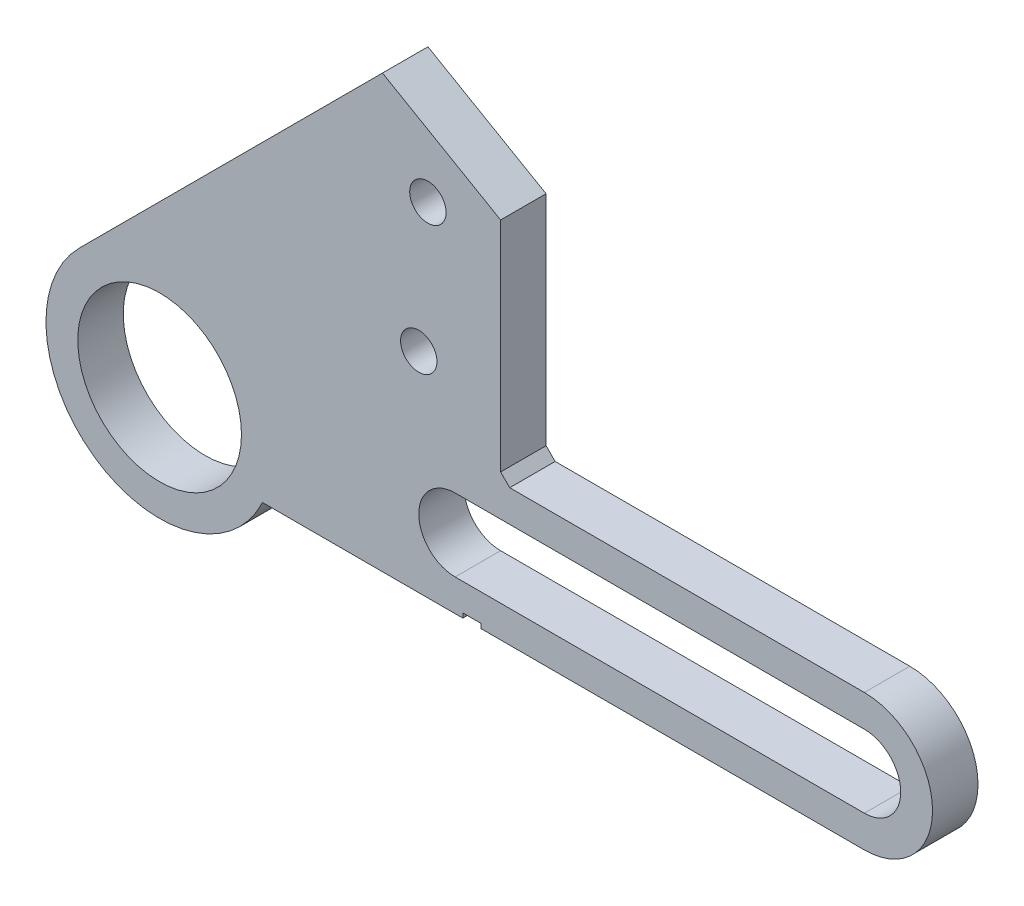
from build123d import *

# Parameters (mm, degrees)
SKETCH_1_R          = 9
EXTRUDE_1_DEPTH     = 5
SKETCH_2_R          = 2
CUT_EXTRUDE_1_DEPTH = 5
CHAMFER_1_SIZE      = 1
SKETCH_3_W          = 2
SKETCH_3_H          = 0.5
CUT_EXTRUDE_2_DEPTH = 7


with BuildPart() as part:
    # 草图1 → 凸台-拉伸1 (new body)
    with BuildSketch(Plane.XY):
        with BuildLine():
            Line((37.5, 34.687288473), (37.5, 9.687288473))
            Line((37.5, 9.687288473), (77.5, 9.687288473))
            ThreePointArc((77.5, 9.687288473), (85, 2.187288473), (77.5, -5.312711527))
            Line((77.5, -5.312711527), (11.314817552, -5.312711527))
            ThreePointArc((11.314817552, -5.312711527), (-7.183257499, -10.229897932), (-8.838834765, 8.838834765))
            Line((-8.838834765, 8.838834765), (24.509618943, 42.187288473))
            Line((24.509618943, 42.187288473), (37.5, 34.687288473))
        make_face()
        Circle(SKETCH_1_R, mode=Mode.SUBTRACT)
        with BuildLine():
            Line((77.5, 6.187288473), (32.499999279, 6.187288473))
            ThreePointArc((32.499999279, 6.187288473), (28.5, 2.187288113), (32.5, -1.812711527))
            Line((32.5, -1.812711527), (77.5, -1.812711527))
            ThreePointArc((77.5, -1.812711527), (81.5, 2.187288473), (77.5, 6.187288473))
        make_face(mode=Mode.SUBTRACT)
    extrude(amount=EXTRUDE_1_DEPTH)

    # 草图2 → 切除-拉伸1 (cut)
    with BuildSketch(Plane(origin=(0, 0, 0), x_dir=(-1, 0, 0), z_dir=(0, 0, -1))):
        with Locations((-28.5, 17.687288473)):
            Circle(SKETCH_2_R)
        with Locations((-29.5, 32.38422693)):
            Circle(SKETCH_2_R)
    extrude(amount=-CUT_EXTRUDE_1_DEPTH, mode=Mode.SUBTRACT)

    # 倒角1
    chamfer_1_edges = [part.edges().sort_by_distance(p)[0] for p in [
        (37.5, 9.687288473, 2.5),
    ]]
    chamfer(chamfer_1_edges, length=CHAMFER_1_SIZE)

    # 草图3 → 切除-拉伸2 (cut)
    with BuildSketch(Plane(origin=(0, 0, 0), x_dir=(-1, 0, 0), z_dir=(0, 0, -1))):
        with Locations((-34.343585868, -5.062711527)):
            Rectangle(SKETCH_3_W, SKETCH_3_H)
    extrude(amount=-CUT_EXTRUDE_2_DEPTH, mode=Mode.SUBTRACT)


solid = part.part
